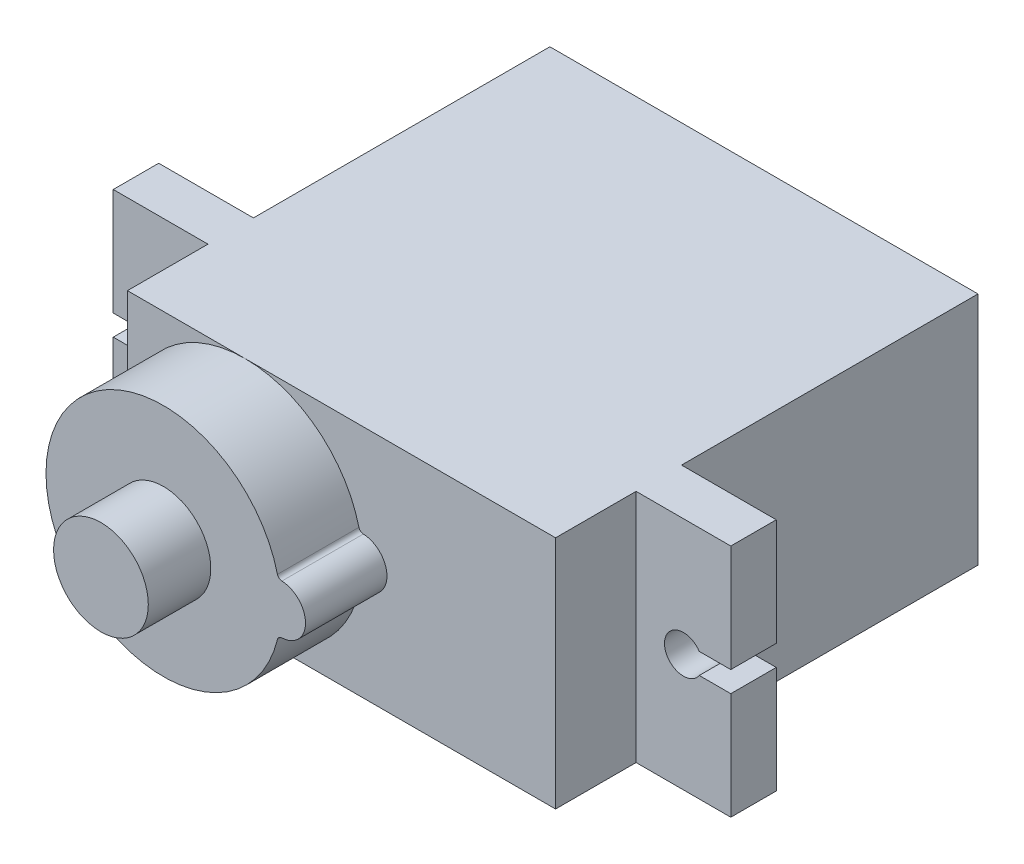
from build123d import *

# Parameters (mm, degrees)
SKETCH1_W             = 22.6
SKETCH1_H             = 12.4
BOSS_EXTRUDE1_DEPTH   = 22.3
SKETCH2_W             = 5
SKETCH2_H             = 2.4
BOSS_EXTRUDE2_DEPTH   = 12.4
CUT_EXTRUDE1_DEPTH    = 22.3
BOSS_EXTRUDE3_DEPTH   = 4.3
SKETCH6_R             = 2.5
BOSS_EXTRUDE4_DEPTH   = 3.3
SKETCH7_R             = 0.6
BOSS_EXTRUDE5_DEPTH   = 3.3
BOSS_EXTRUDE5_2_DEPTH = 3.3
BOSS_EXTRUDE5_3_DEPTH = 3.3


with BuildPart() as part:
    # Sketch1 → Boss-Extrude1 (new body)
    with BuildSketch(Plane.XY):
        Rectangle(SKETCH1_W, SKETCH1_H)
    extrude(amount=BOSS_EXTRUDE1_DEPTH)

    # Sketch2 → Boss-Extrude2 (add)
    with BuildSketch(Plane.XZ.offset(6.2)):
        with Locations((13.8, 16.85)):
            Rectangle(SKETCH2_W, SKETCH2_H)
        with Locations((-13.8, 16.85)):
            Rectangle(SKETCH2_W, SKETCH2_H)
    extrude(amount=-BOSS_EXTRUDE2_DEPTH)

    # Sketch3 → Cut-Extrude1 (cut)
    with BuildSketch(Plane.XY.offset(18.05)):
        with BuildLine():
            Line((14.635164654, 0.55), (16.3, 0.55))
            Line((16.3, 0.55), (16.3, -0.55))
            Line((16.3, -0.55), (14.635164654, -0.55))
            ThreePointArc((14.635164654, -0.55), (12.8, 0), (14.635164654, 0.55))
        make_face()
        with BuildLine():
            Line((-16.3, -0.55), (-14.635164654, -0.55))
            ThreePointArc((-14.635164654, -0.55), (-12.8, 0), (-14.635164654, 0.55))
            Line((-14.635164654, 0.55), (-16.3, 0.55))
            Line((-16.3, 0.55), (-16.3, -0.55))
        make_face()
    extrude(amount=-CUT_EXTRUDE1_DEPTH, mode=Mode.SUBTRACT)

    # Sketch4 → Boss-Extrude3 (add)
    with BuildSketch(Plane.XY.offset(22.3)):
        with BuildLine():
            ThreePointArc((0.918604651, 1.488757218), (-11.3, 0), (0.918604651, -1.488757218))
            ThreePointArc((0.918604651, -1.488757218), (1.003329596, -1.355013632), (1.151404787, -1.298983275))
            ThreePointArc((1.151404787, -1.298983275), (2.4, 0), (1.151404787, 1.298983275))
            ThreePointArc((1.151404787, 1.298983275), (1.003329596, 1.355013632), (0.918604651, 1.488757218))
        make_face()
    extrude(amount=BOSS_EXTRUDE3_DEPTH)

    # Sketch6 → Boss-Extrude4 (add)
    with BuildSketch(Plane.XY.offset(26.6)):
        with Locations(Location((-5.1, 0, 0), (0, 0, 180))):
            Circle(SKETCH6_R)
    extrude(amount=BOSS_EXTRUDE4_DEPTH)


with BuildPart() as body_2:
    # Sketch7 → Boss-Extrude5 (new body)
    with BuildSketch(Plane.ZY.offset(11.3)):
        with Locations(Location((4.5, 1.2, 0), (0, 0, 270))):
            Circle(SKETCH7_R)
    extrude(amount=BOSS_EXTRUDE5_DEPTH)


with BuildPart() as body_3:
    # Sketch7 → Boss-Extrude5 2 (new body)
    with BuildSketch(Plane.ZY.offset(11.3)):
        with Locations(Location((4.5, 0, 0), (0, 0, 270))):
            Circle(SKETCH7_R)
    extrude(amount=BOSS_EXTRUDE5_2_DEPTH)


with BuildPart() as body_4:
    # Sketch7 → Boss-Extrude5 3 (new body)
    with BuildSketch(Plane.ZY.offset(11.3)):
        with Locations(Location((4.5, -1.2, 0), (0, 0, 270))):
            Circle(SKETCH7_R)
    extrude(amount=BOSS_EXTRUDE5_3_DEPTH)


solid = Compound([part.part, body_2.part, body_3.part, body_4.part])
